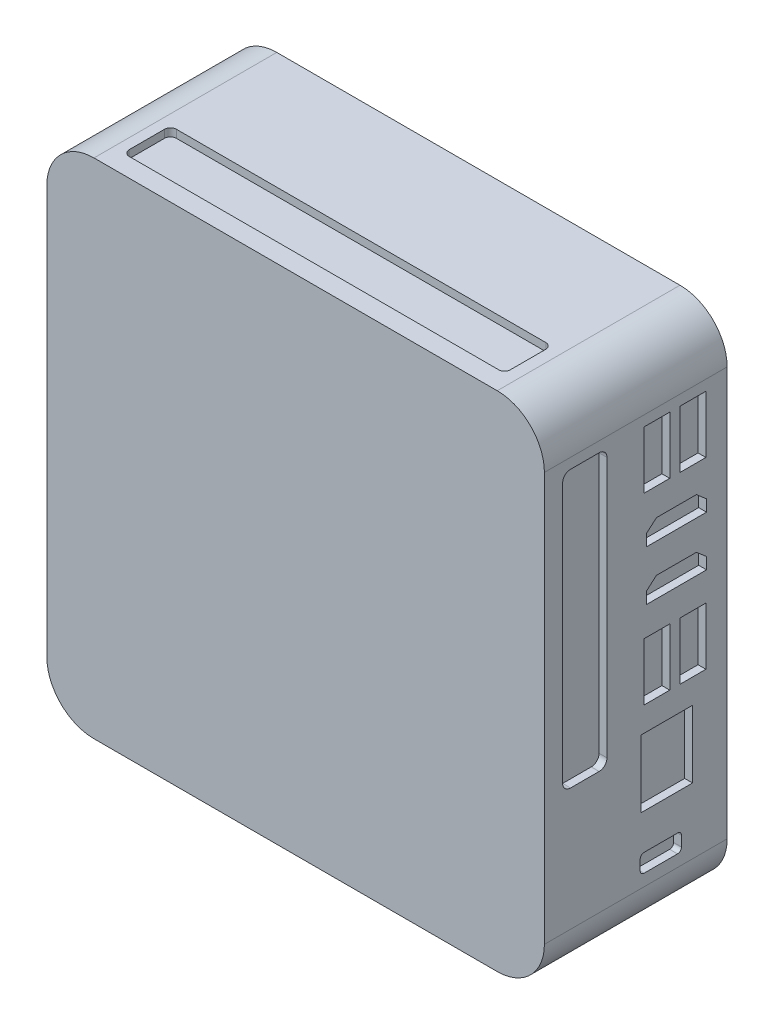
from build123d import *

# Parameters (mm, degrees)
DODANIE_WYCI_GNI_CIE1_DEPTH = 46.5
WYTNIJ_WYCI_GNI_CIE1_DEPTH  = 2
SZKIC3_R                    = 3.25
WYTNIJ_WYCI_GNI_CIE2_DEPTH  = 2
DODANIE_WYCI_GNI_CIE2_DEPTH = 2
SZKIC5_W                    = 6.61
SZKIC5_H                    = 14.6
SZKIC5_W_2                  = 13.12
SZKIC5_H_2                  = 17.13
WYTNIJ_WYCI_GNI_CIE3_DEPTH  = 2


with BuildPart() as part:
    # Szkic1 → Dodanie-wyciągnięcie1 (new body)
    with BuildSketch(Plane.XY):
        with BuildLine():
            Line((-51.3, -64), (51.3, -64))
            ThreePointArc((51.3, -64), (59.785281374, -60.485281374), (63.3, -52))
            Line((63.3, -52), (63.3, 52))
            ThreePointArc((63.3, 52), (59.785281374, 60.485281374), (51.3, 64))
            Line((51.3, 64), (-51.3, 64))
            ThreePointArc((-51.3, 64), (-59.785281374, 60.485281374), (-63.3, 52))
            Line((-63.3, 52), (-63.3, -52))
            ThreePointArc((-63.3, -52), (-59.785281374, -60.485281374), (-51.3, -64))
        make_face()
    extrude(amount=DODANIE_WYCI_GNI_CIE1_DEPTH)

    # Szkic2 → Wytnij-wyciągnięcie1 (cut)
    with BuildSketch(Plane(origin=(0, 64, 0), x_dir=(1, 0, 0), z_dir=(0, 1, 0))):
        with BuildLine():
            Line((-48.65, -31.2), (-48.65, -40.2))
            ThreePointArc((-48.65, -40.2), (-48.210660172, -41.260660172), (-47.15, -41.7))
            Line((-47.15, -41.7), (46.85, -41.7))
            ThreePointArc((46.85, -41.7), (47.910660172, -41.260660172), (48.35, -40.2))
            Line((48.35, -40.2), (48.35, -31.2))
            ThreePointArc((48.35, -31.2), (47.910660172, -30.139339828), (46.85, -29.7))
            Line((46.85, -29.7), (-47.15, -29.7))
            ThreePointArc((-47.15, -29.7), (-48.210660172, -30.139339828), (-48.65, -31.2))
        make_face()
    wytnij_wyci_gni_cie1 = extrude(amount=-WYTNIJ_WYCI_GNI_CIE1_DEPTH, mode=Mode.SUBTRACT)

    # Szkic3 → Wytnij-wyciągnięcie2 (cut)
    with BuildSketch(Plane.ZY.offset(63.3)):
        with BuildLine():
            ThreePointArc((28, -44.3), (28.439339828, -45.360660172), (29.5, -45.8))
            Line((29.5, -45.8), (38.5, -45.8))
            ThreePointArc((38.5, -45.8), (39.560660172, -45.360660172), (40, -44.3))
            Line((40, -44.3), (40, 43.7))
            ThreePointArc((40, 43.7), (39.560660172, 44.760660172), (38.5, 45.2))
            Line((38.5, 45.2), (29.5, 45.2))
            ThreePointArc((29.5, 45.2), (28.439339828, 44.760660172), (28, 43.7))
            Line((28, 43.7), (28, -44.3))
        make_face()
        with BuildLine():
            Line((17.02769909, -28.8), (17.02769909, -23))
            ThreePointArc((17.02769909, -23), (15.37769909, -21.35), (13.72769909, -23))
            Line((13.72769909, -23), (13.72769909, -28.8))
            ThreePointArc((13.72769909, -28.8), (15.37769909, -30.45), (17.02769909, -28.8))
        make_face()
        with BuildLine():
            Line((17.02769909, -9.7), (17.02769909, -3.9))
            ThreePointArc((17.02769909, -3.9), (15.37769909, -2.25), (13.72769909, -3.9))
            Line((13.72769909, -3.9), (13.72769909, -9.7))
            ThreePointArc((13.72769909, -9.7), (15.37769909, -11.35), (17.02769909, -9.7))
        make_face()
        with Locations((15.37769909, 10.1)):
            Circle(SZKIC3_R)
    extrude(amount=-WYTNIJ_WYCI_GNI_CIE2_DEPTH, mode=Mode.SUBTRACT)

    # Szkic3<3> → Dodanie-wyciągnięcie2 (add)
    with BuildSketch(Plane.ZY.offset(63.3)):
        with BuildLine():
            Line((17.37769909, 32.6), (13.37769909, 32.6))
            ThreePointArc((13.37769909, 32.6), (12.670592309, 32.307106781), (12.37769909, 31.6))
            Line((12.37769909, 31.6), (12.37769909, 23.1))
            ThreePointArc((12.37769909, 23.1), (12.670592309, 22.392893219), (13.37769909, 22.1))
            Line((13.37769909, 22.1), (17.37769909, 22.1))
            ThreePointArc((17.37769909, 22.1), (18.084805871, 22.392893219), (18.37769909, 23.1))
            Line((18.37769909, 23.1), (18.37769909, 31.6))
            ThreePointArc((18.37769909, 31.6), (18.084805871, 32.307106781), (17.37769909, 32.6))
        make_face()
    extrude(amount=DODANIE_WYCI_GNI_CIE2_DEPTH)

    # Lustro1: Wytnij-wyciągnięcie1 across plane
    add(wytnij_wyci_gni_cie1.mirror(Plane.ZX), mode=Mode.SUBTRACT)

    # Szkic5 → Wytnij-wyciągnięcie3 (cut)
    with BuildSketch(Plane(origin=(63.3, 0, 0), x_dir=(0, 0, -1), z_dir=(1, 0, 0))):
        with BuildLine():
            Line((-39.86, 49.36), (-32.58, 49.36))
            ThreePointArc((-32.58, 49.36), (-31.165786438, 48.774213562), (-30.58, 47.36))
            Line((-30.58, 47.36), (-30.58, -18.86))
            ThreePointArc((-30.58, -18.86), (-31.165786438, -20.274213562), (-32.58, -20.86))
            Line((-32.58, -20.86), (-39.86, -20.86))
            ThreePointArc((-39.86, -20.86), (-41.274213562, -20.274213562), (-41.86, -18.86))
            Line((-41.86, -18.86), (-41.86, 47.36))
            ThreePointArc((-41.86, 47.36), (-41.274213562, 48.774213562), (-39.86, 49.36))
        make_face()
        with BuildLine():
            Line((-21.12, -44.41), (-12.62, -44.41))
            ThreePointArc((-12.62, -44.41), (-11.912893219, -44.702893219), (-11.62, -45.41))
            Line((-11.62, -45.41), (-11.62, -48))
            ThreePointArc((-11.62, -48), (-11.912893219, -48.707106781), (-12.62, -49))
            Line((-12.62, -49), (-21.12, -49))
            ThreePointArc((-21.12, -49), (-21.827106781, -48.707106781), (-22.12, -48))
            Line((-22.12, -48), (-22.12, -45.41))
            ThreePointArc((-22.12, -45.41), (-21.827106781, -44.702893219), (-21.12, -44.41))
        make_face()
        with Locations((-8.705, -4.63)):
            Rectangle(SZKIC5_W, SZKIC5_H)
        with Locations((-15.36, -26.725)):
            Rectangle(SZKIC5_W_2, SZKIC5_H_2)
        with Locations((-17.905, -4.63)):
            Rectangle(SZKIC5_W, SZKIC5_H)
        Polygon((-20.57, 9.9), (-5.24, 9.9), (-5.24, 12.83), (-7.82, 15.06), (-17.99, 15.06), (-20.57, 12.83), align=None)
        Polygon((-7.82, 27.77), (-5.24, 25.54), (-5.24, 22.61), (-20.57, 22.61), (-20.57, 25.54), (-17.99, 27.77), align=None)
        with Locations((-17.905, 42.04)):
            Rectangle(SZKIC5_W, SZKIC5_H)
        with Locations((-8.705, 42.04)):
            Rectangle(SZKIC5_W, SZKIC5_H)
    extrude(amount=-WYTNIJ_WYCI_GNI_CIE3_DEPTH, mode=Mode.SUBTRACT)


solid = part.part
